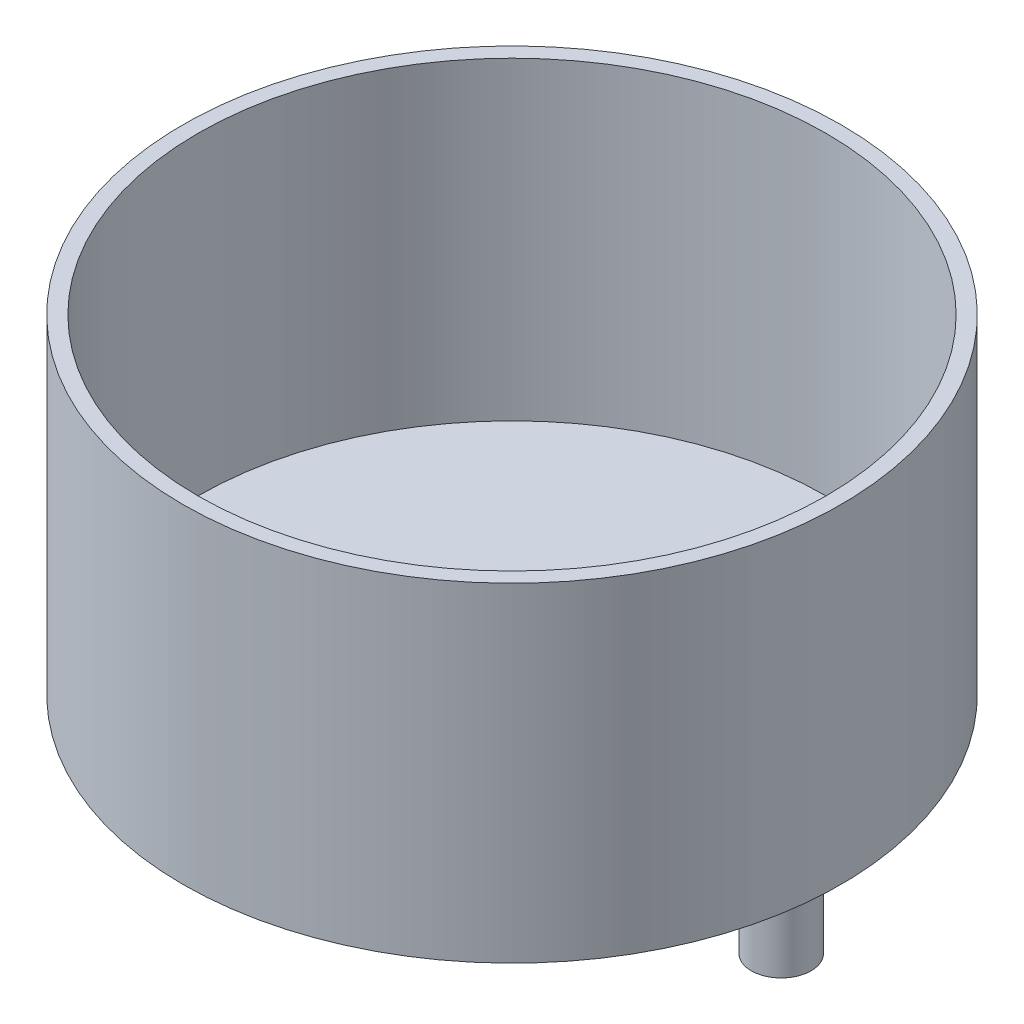
from build123d import *

# Parameters (mm, degrees)
CUT_EXTRUDE2_REACH  = 192.526
MOTOR_HOLE_R        = 4.5
STABLIZING_POLES_R  = 10
BOSS_EXTRUDE1_DEPTH = 30


with BuildPart() as part:
    # Compartment → Revolve1 (revolve)
    with BuildSketch(Plane.XY, mode=Mode.PRIVATE) as revolve1_sk:
        Polygon((110, -80), (0, -80), (0, -75), (105, -75), (105, 30), (110, 30), align=None)
    revolve(revolve1_sk.sketch.rotate(Axis((0, 0, 0), (0, 1, 0)), 90), axis=Axis((0, 0, 0), (0, 1, 0)))

    # Motor Hole → Cut-Extrude2 (cut, up to next)
    with BuildSketch(Plane.XZ.offset(80), mode=Mode.PRIVATE) as cut_extrude2_sk1:
        with Locations(Location((0, 0, 0), (0, 0, 270))):
            Circle(MOTOR_HOLE_R)
    cut_extrude2_tool1 = extrude(cut_extrude2_sk1.sketch, amount=-CUT_EXTRUDE2_REACH, mode=Mode.PRIVATE) & part.part
    add(cut_extrude2_tool1.solids().sort_by_distance((0, -80, 0))[0], mode=Mode.SUBTRACT)

    # Stablizing poles → Boss-Extrude1 (add)
    with BuildSketch(Plane.XZ.offset(80)):
        with Locations(Location((-90, 0, 0), (0, 0, 270))):
            Circle(STABLIZING_POLES_R)
        with Locations(Location((90, 0, 0), (0, 0, 270))):
            Circle(STABLIZING_POLES_R)
    extrude(amount=BOSS_EXTRUDE1_DEPTH)


solid = part.part
